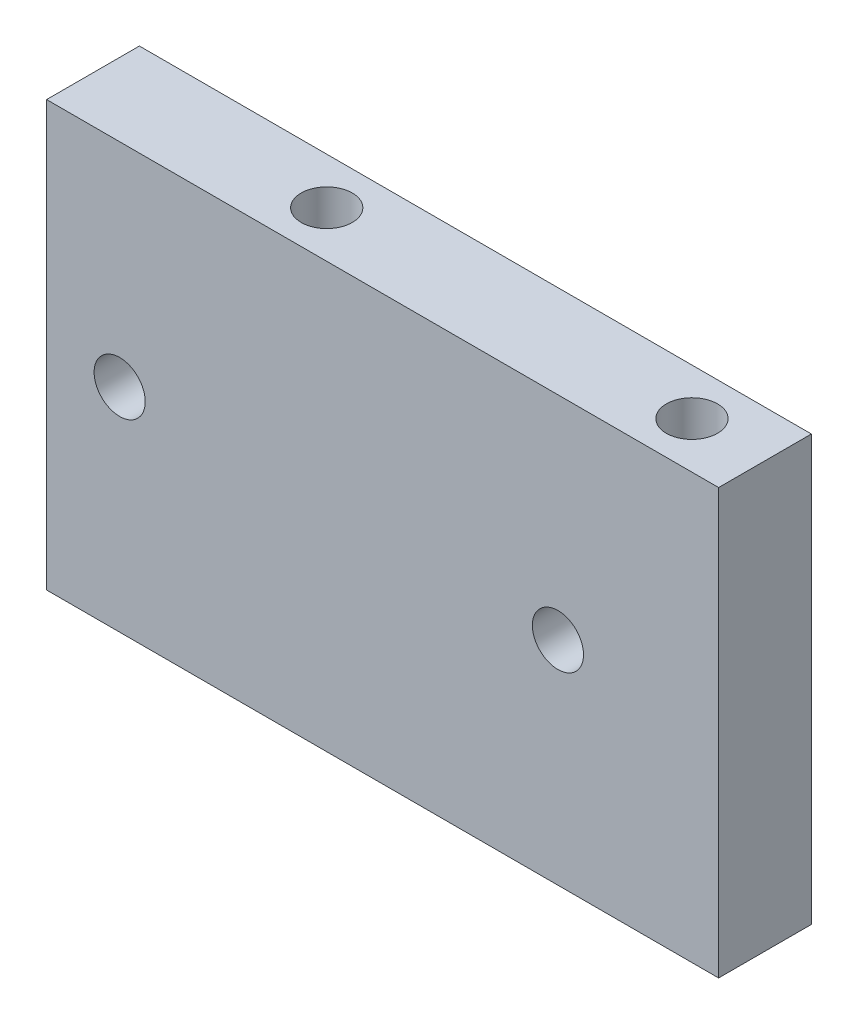
from build123d import *

# Parameters (mm, degrees)
SKETCH1_W         = 46
SKETCH1_H         = 29.075
EXTRUDE_1_4_DEPTH = 6.35
SKETCH2_R         = 1.75
M4_DRILL_DEPTH    = 6.35
SKETCH3_R         = 1.75
M4_DRILL2_DEPTH   = 8
M4_DRILL3_START   = -8
SKETCH4_R         = 1.75
M4_DRILL3_DEPTH   = 8


with BuildPart() as part:
    # Sketch1 → 1/4 (new body)
    with BuildSketch(Plane.XY):
        Rectangle(SKETCH1_W, SKETCH1_H)
    extrude(amount=EXTRUDE_1_4_DEPTH)

    # Sketch2 → M4_DRILL (cut)
    with BuildSketch(Plane.XY):
        with Locations((-18, 0)):
            Circle(SKETCH2_R)
        with Locations((12, 0)):
            Circle(SKETCH2_R)
    extrude(amount=M4_DRILL_DEPTH, mode=Mode.SUBTRACT)

    # Sketch3 → M4_DRILL2 (cut)
    with BuildSketch(Plane.XZ.offset(14.5375)):
        with Locations(Location((-7, 3.175, 0), (0, 0, 270))):
            Circle(SKETCH3_R)
        with Locations(Location((18, 3.175, 0), (0, 0, 270))):
            Circle(SKETCH3_R)
    extrude(amount=-M4_DRILL2_DEPTH, mode=Mode.SUBTRACT)

    # Sketch4 → M4_DRILL3 (cut)
    with BuildSketch(Plane(origin=(0, 14.5375, 0), x_dir=(1, 0, 0), z_dir=(0, 1, 0)).offset(M4_DRILL3_START)):
        with Locations(Location((18, -3.175, 0), (0, 0, 90))):
            Circle(SKETCH4_R)
        with Locations(Location((-7, -3.175, 0), (0, 0, 90))):
            Circle(SKETCH4_R)
    extrude(amount=M4_DRILL3_DEPTH, mode=Mode.SUBTRACT)


solid = part.part
